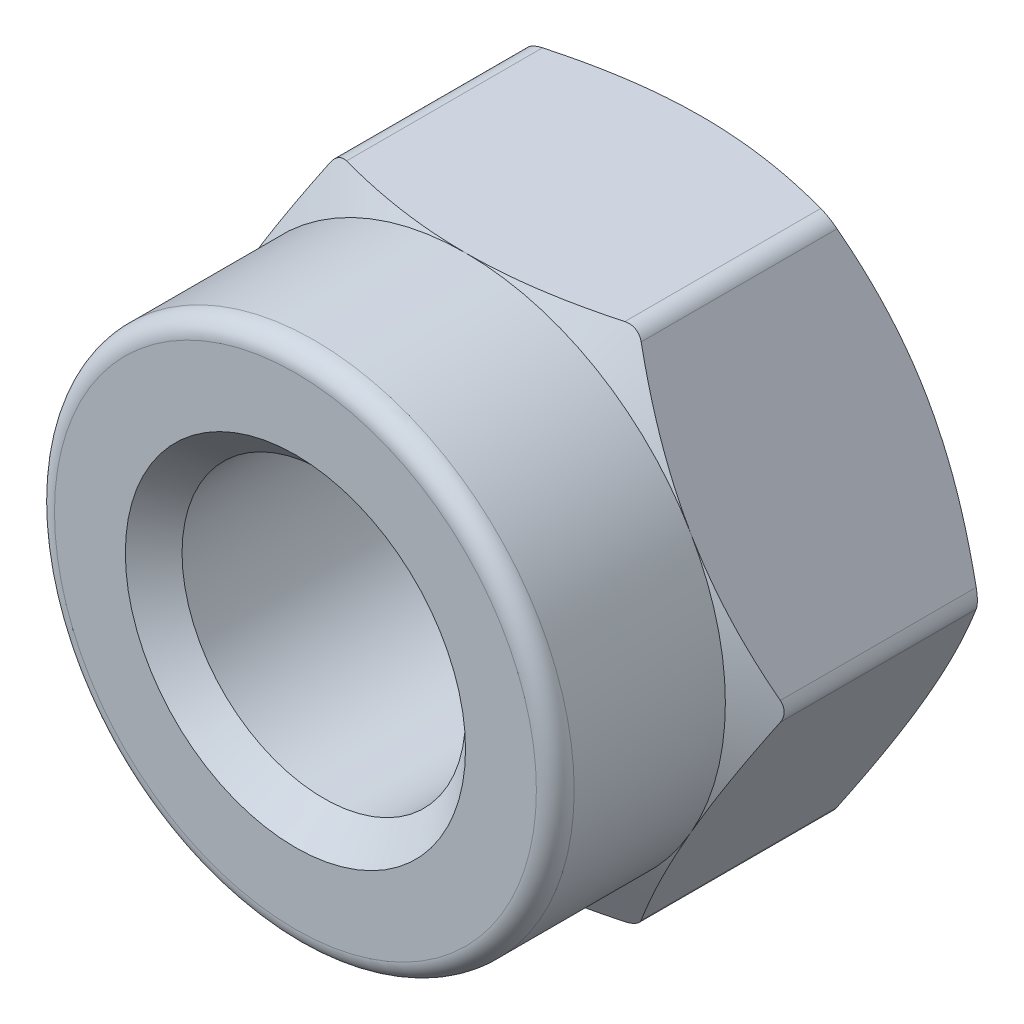
from build123d import *

# Parameters (mm, degrees)
EXTRUDE_307_DEPTH     = 2.5
SKETCH_2_R            = 2.75
EXTRUDE_489_DEPTH     = 1.8
SKETCH_3_R            = 1.5
CUT_EXTRUDE_587_DEPTH = 7.011308787
FILLET_2_R            = 0.2
CHAMFER_1_SIZE        = 0.3
CHAMFER_2_SIZE        = 0.3
FILLET_3_R            = 0.2


with BuildPart() as part:
    # 草图1 → Extrude 307 (new body)
    with BuildSketch(Plane.XY):
        Polygon((3.175426481, 0), (1.58771324, 2.75), (-1.58771324, 2.75), (-3.175426481, 0), (-1.58771324, -2.75), (1.58771324, -2.75), align=None)
    extrude(amount=EXTRUDE_307_DEPTH)

    # 草图2 → Extrude 489 (add)
    with BuildSketch(Plane.XY.offset(2.5)):
        with Locations(Location((0, 0, 0), (0, 0, 150))):
            Circle(SKETCH_2_R)
    extrude(amount=EXTRUDE_489_DEPTH)

    # 草图3 → Cut-Extrude 587 (cut, through all)
    with BuildSketch(Plane.XY.offset(4.3)):
        Circle(SKETCH_3_R)
    extrude(amount=-CUT_EXTRUDE_587_DEPTH, mode=Mode.SUBTRACT)

    # 圆角2
    fillet_2_edges = [part.edges().sort_by_distance(p)[0] for p in [
        (1.58771324, -2.75, 1.25),
        (-1.58771324, -2.75, 1.25),
        (-3.175426481, 0, 1.25),
        (-1.58771324, 2.75, 1.25),
        (1.58771324, 2.75, 1.25),
        (3.175426481, 0, 1.25),
    ]]
    fillet(fillet_2_edges, radius=FILLET_2_R)

    # 倒角1
    chamfer_1_edges = [part.edges().sort_by_distance(p)[0] for p in [
        (-1.5, 0, 0),
    ]]
    chamfer(chamfer_1_edges, length=CHAMFER_1_SIZE)

    # 倒角2
    chamfer_2_edges = [part.edges().sort_by_distance(p)[0] for p in [
        (-1.5, 0, 4.3),
    ]]
    chamfer(chamfer_2_edges, length=CHAMFER_2_SIZE)

    # 草图6 → 切除-旋转2 (revolve, cut)
    with BuildSketch(Plane(origin=(0, 0, 0), x_dir=(1, 0, 0), z_dir=(0, 1, 0))):
        Polygon((-2.75, 0), (-3.144486373, -0.227756814), (-3.144486373, 0), align=None)
        Polygon((-3.144486373, -2.5), (-3.144486373, -2.272243186), (-2.75, -2.5), align=None)
    revolve(axis=Axis((0, 0, -1.923239397), (0, 0, 1)), mode=Mode.SUBTRACT)

    # 圆角3
    fillet_3_edges = [part.edges().sort_by_distance(p)[0] for p in [
        (2.38156986, -1.375, 4.3),
    ]]
    fillet(fillet_3_edges, radius=FILLET_3_R)


solid = part.part
